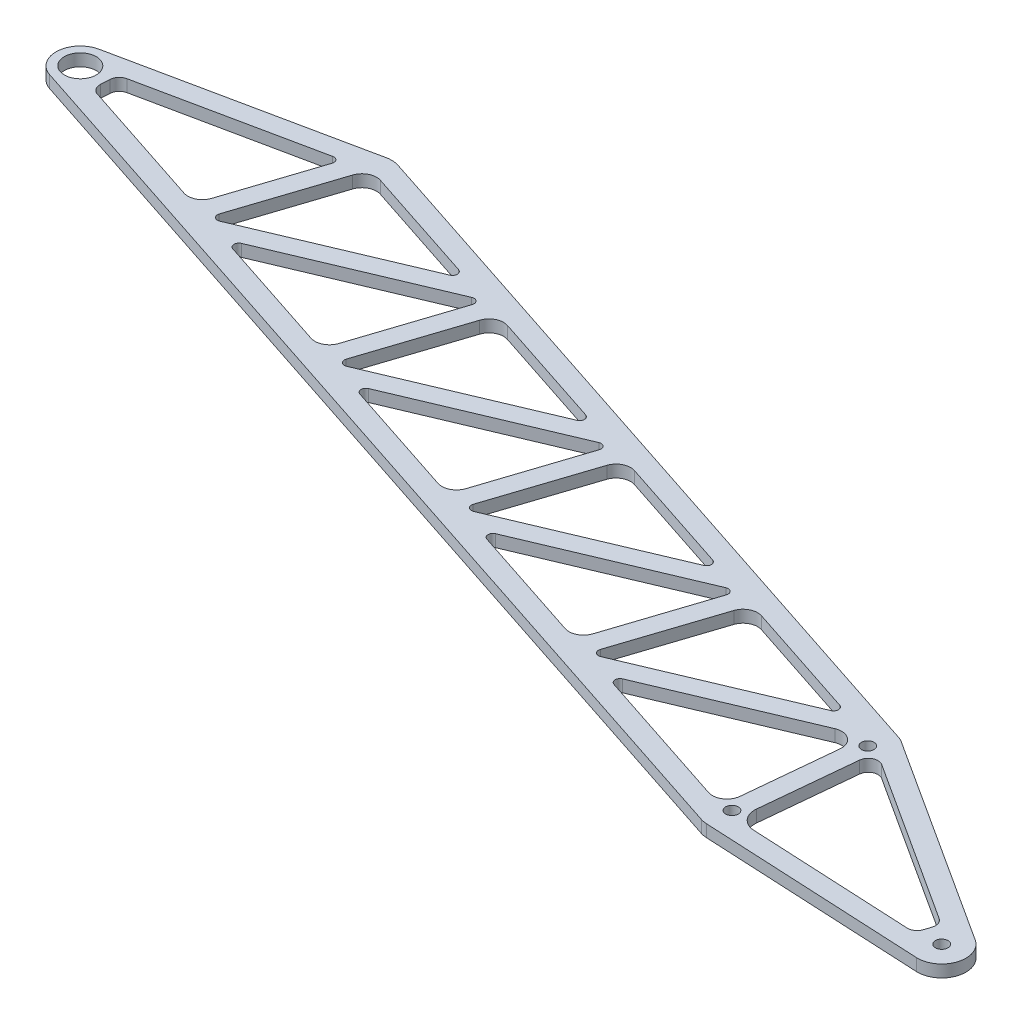
from build123d import *

# Parameters (mm, degrees)
BOSS_EXTRUDE1_DEPTH      = 3.175
BOSS_EXTRUDE1_DEPTH_BACK = 3.175
SKETCH2_R                = 8.334375
SKETCH2_R_2              = 3.302
CUT_EXTRUDE1_DEPTH       = 663.832858032
RIGHT_ANGLES_R           = 7.62
FILLET9_R                = 9.398
FILLET10_R               = 7.62
FILLET11_R               = 5.08
FILLET13_R               = 5.08
FILLET14_R               = 2.54


with BuildPart() as part:
    # Sketch2 → Boss-Extrude1 (new, two sides: drawn at the far end of the back side and taken through both)
    with BuildSketch(Plane(origin=(0, 0, 0), x_dir=(1, 0, 0), z_dir=(0, 1, 0)).offset(-BOSS_EXTRUDE1_DEPTH_BACK)):
        with BuildLine():
            Line((-3.965619751, -12.064984873), (504.134113458, -179.071438566))
            ThreePointArc((504.134113458, -179.071438566), (505.781320473, -179.493044996), (507.470083881, -179.690835496))
            Line((507.470083881, -179.690835496), (623.002452599, -185.425831444))
            ThreePointArc((623.002452599, -185.425831444), (635.721308663, -176.632603773), (630.519585141, -162.071277432))
            Line((630.519585141, -162.071277432), (521.293179876, -91.566789023))
            ThreePointArc((521.293179876, -91.566789023), (519.876879037, -90.77588958), (518.371316412, -90.171976358))
            Line((518.371316412, -90.171976358), (128.279552471, 38.046634777))
            ThreePointArc((128.279552471, 38.046634777), (125.021779391, 38.661908304), (121.715767729, 38.413043176))
            Line((121.715767729, 38.413043176), (-2.59816499, 12.431393272))
            ThreePointArc((-2.59816499, 12.431393272), (-12.6802584, 0.707846671), (-3.965619751, -12.064984873))
        make_face()
        Circle(SKETCH2_R, mode=Mode.SUBTRACT)
        with Locations((623.632101926, -172.741449641)):
            Circle(SKETCH2_R_2, mode=Mode.SUBTRACT)
        with Locations((508.099733209, -167.006453693)):
            Circle(SKETCH2_R_2, mode=Mode.SUBTRACT)
        with Locations((514.405696661, -102.236961232)):
            Circle(SKETCH2_R_2, mode=Mode.SUBTRACT)
    extrude(amount=BOSS_EXTRUDE1_DEPTH + BOSS_EXTRUDE1_DEPTH_BACK)

    # Sketch4 → Cut-Extrude1 (cut, through all)
    with BuildSketch(Plane(origin=(0, 3.175, 0), x_dir=(1, 0, 0), z_dir=(0, 1, 0))):
        Polygon((123.173594128, 29.030153456), (101.759247472, -36.120764859), (197.883708709, 4.473810527), align=None)
        Polygon((212.569250905, -0.353155839), (116.444789668, -40.947731225), (191.154904249, -65.504074154), align=None)
        Polygon((222.221238803, -3.52565164), (200.806892147, -68.676569955), (296.931353384, -28.08199457), align=None)
        Polygon((311.61689558, -32.908960935), (215.492434343, -73.503536321), (290.202548924, -98.059879251), align=None)
        Polygon((321.268883479, -36.081456736), (299.854536823, -101.232375051), (395.97899806, -60.637799666), align=None)
        Polygon((410.664540256, -65.464766032), (314.540079019, -106.059341417), (389.2501936, -130.615684347), align=None)
        Polygon((519.484855658, -102.492310656), (512.932796085, -169.789493129), (604.57066912, -174.338372689), (611.078066813, -174.661398174), (614.555007617, -163.859087404), (609.080948645, -160.325640282), align=None)
        Polygon((509.712184931, -98.020571128), (413.587723694, -138.615146514), (502.901744402, -167.971622986), align=None)
        Polygon((420.316528154, -68.637261833), (398.902181498, -133.788180148), (495.026642735, -93.193604762), align=None)
        Polygon((22.677662652, 7.33452053), (111.445751733, 25.887078258), (92.107259573, -32.948269058), (21.720444319, -9.812944172), (13.482358668, -7.105181542), (14.189389884, 5.560468929), align=None)
    extrude(amount=-CUT_EXTRUDE1_DEPTH, mode=Mode.SUBTRACT)

    # right angles
    right_angles_edges = [part.edges().sort_by_distance(p)[0] for p in [
        (420.316528154, 0, 68.637261833),
        (321.268883479, 0, 36.081456736),
        (389.2501936, 0, 130.615684347),
        (502.901744402, 0, 167.971622986),
        (290.202548924, 0, 98.059879251),
        (222.221238803, 0, 3.52565164),
        (191.154904249, 0, 65.504074154),
        (123.173594128, 0, -29.030153456),
        (92.107259573, 0, 32.948269058),
    ]]
    fillet(right_angles_edges, radius=RIGHT_ANGLES_R)

    # Fillet9
    fillet9_edges = [part.edges().sort_by_distance(p)[0] for p in [
        (512.932796085, 0, 169.789493129),
    ]]
    fillet(fillet9_edges, radius=FILLET9_R)

    # Fillet10
    fillet10_edges = [part.edges().sort_by_distance(p)[0] for p in [
        (509.712184931, 0, 98.020571128),
    ]]
    fillet(fillet10_edges, radius=FILLET10_R)

    # Fillet11
    fillet11_edges = [part.edges().sort_by_distance(p)[0] for p in [
        (519.484855658, 0, 102.492310656),
    ]]
    fillet(fillet11_edges, radius=FILLET11_R)

    # Fillet13
    fillet13_edges = [part.edges().sort_by_distance(p)[0] for p in [
        (614.555007617, 0, 163.859087404),
        (611.078066813, 0, 174.661398174),
        (13.482358668, 0, 7.105181542),
        (14.189389884, 0, -5.560468929),
    ]]
    fillet(fillet13_edges, radius=FILLET13_R)

    # Fillet14
    fillet14_edges = [part.edges().sort_by_distance(p)[0] for p in [
        (410.664540256, 0, 65.464766032),
        (311.61689558, 0, 32.908960935),
        (413.587723694, 0, 138.615146514),
        (215.492434343, 0, 73.503536321),
        (314.540079019, 0, 106.059341417),
        (398.902181498, 0, 133.788180148),
        (299.854536823, 0, 101.232375051),
        (200.806892147, 0, 68.676569955),
        (212.569250905, 0, 0.353155839),
        (101.759247472, 0, 36.120764859),
        (116.444789668, 0, 40.947731225),
        (495.026642735, 0, 93.193604762),
        (395.97899806, 0, 60.637799666),
        (296.931353384, 0, 28.08199457),
        (197.883708709, 0, -4.473810527),
        (111.445751733, 0, -25.887078258),
    ]]
    fillet(fillet14_edges, radius=FILLET14_R)


solid = part.part
